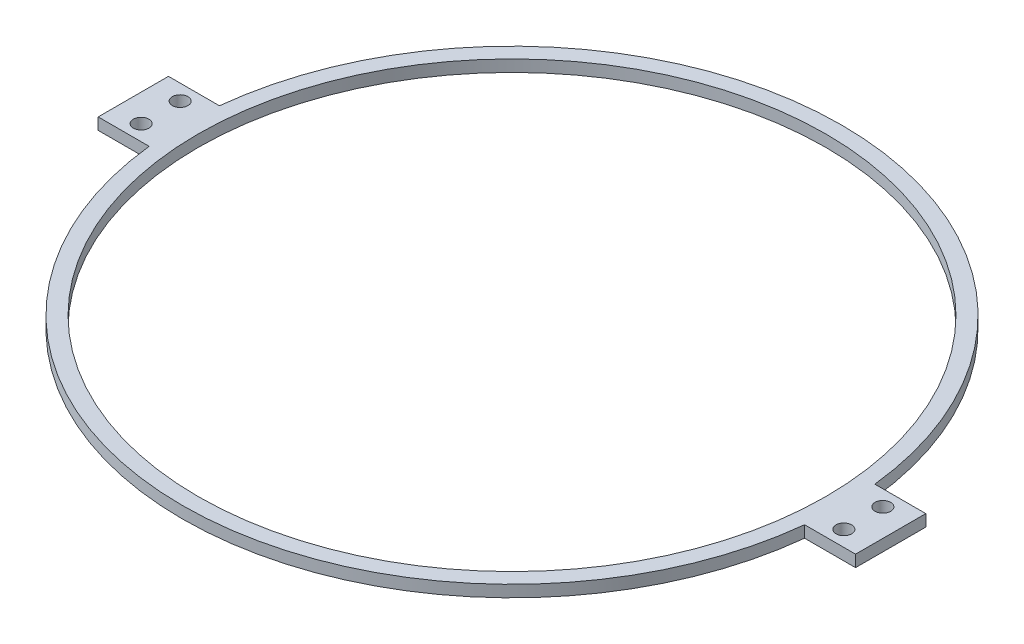
from build123d import *

# Parameters (mm, degrees)
CROQUIS1_R              = 2
CROQUIS1_R_2            = 84.42
CROQUIS1_R_3            = 80.42
SALIENTE_EXTRUIR1_DEPTH = 3


with BuildPart() as part:
    # Croquis1 → Saliente-Extruir1 (new body)
    # profile 1 of 3: a face of its own
    with BuildSketch(Plane(origin=(0, 0, 0), x_dir=(1, 0, 0), z_dir=(0, 1, 0))):
        with BuildLine():
            Line((83.93888491, -9), (97, -9))
            Line((97, -9), (97, 9))
            Line((97, 9), (83.93888491, 9))
            ThreePointArc((83.93888491, 9), (84.299635421, 4.506425183), (84.42, 0))
            ThreePointArc((84.42, 0), (84.299635421, -4.506425183), (83.93888491, -9))
        make_face()
        with Locations(Location((90, -5, 0), (0, 0, 270))):
            Circle(CROQUIS1_R, mode=Mode.SUBTRACT)
        with Locations(Location((90, 5, 0), (0, 0, 270))):
            Circle(CROQUIS1_R, mode=Mode.SUBTRACT)
    # profile 2 of 3: a face of its own
    with BuildSketch(Plane(origin=(0, 0, 0), x_dir=(1, 0, 0), z_dir=(0, 1, 0))):
        Circle(CROQUIS1_R_2)
        with Locations(Location((0, 0, 0), (0, 0, 270))):
            Circle(CROQUIS1_R_3, mode=Mode.SUBTRACT)
    # profile 3 of 3: a face of its own
    with BuildSketch(Plane(origin=(0, 0, 0), x_dir=(1, 0, 0), z_dir=(0, 1, 0))):
        with BuildLine():
            Line((-97, -9), (-83.93888491, -9))
            ThreePointArc((-83.93888491, -9), (-84.42, 0), (-83.93888491, 9))
            Line((-83.93888491, 9), (-97, 9))
            Line((-97, 9), (-97, -9))
        make_face()
        with Locations(Location((-90, -5, 0), (0, 0, 270))):
            Circle(CROQUIS1_R, mode=Mode.SUBTRACT)
        with Locations(Location((-90, 5, 0), (0, 0, 270))):
            Circle(CROQUIS1_R, mode=Mode.SUBTRACT)
    extrude(amount=SALIENTE_EXTRUIR1_DEPTH)


solid = part.part
